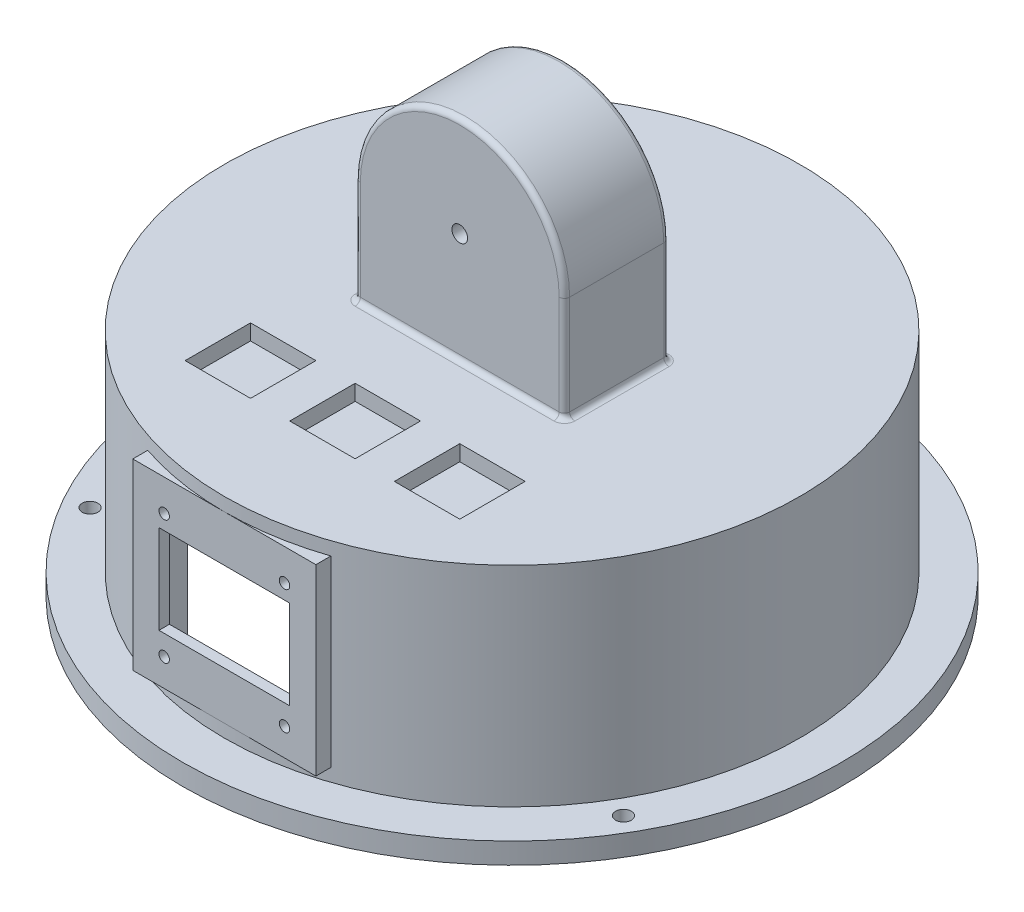
from build123d import *

# Parameters (mm, degrees)
SKETCH1_R            = 63
BOSS_EXTRUDE4_DEPTH  = 4
SKETCH2_R            = 55
BOSS_EXTRUDE5_DEPTH  = 40
SKETCH3_R            = 51
CUT_EXTRUDE1_DEPTH   = 40
SKETCH9_W            = 40
SKETCH9_H            = 20
BOSS_EXTRUDE8_DEPTH  = 0.001
BOSS_EXTRUDE9_DEPTH  = 20
SKETCH12_R           = 1.5
CUT_EXTRUDE4_DEPTH   = 20
BOSS_EXTRUDE10_START = -9
SKETCH22_W           = 35
SKETCH22_H           = 35
BOSS_EXTRUDE10_DEPTH = 9
SKETCH24_W           = 32
SKETCH24_H           = 32
CUT_EXTRUDE15_DEPTH  = 7
FILLET6_R            = 1
SKETCH25_W           = 25
SKETCH25_H           = 17
CUT_EXTRUDE16_DEPTH  = 2
SKETCH26_R           = 1
CUT_EXTRUDE18_DEPTH  = 2
SKETCH30_W           = 12.5
SKETCH30_H           = 12.5
CUT_EXTRUDE24_DEPTH  = 3
SKETCH29_R           = 1.5
CUT_EXTRUDE25_DEPTH  = 4


with BuildPart() as part:
    # Sketch1 → Boss-Extrude4 (new body)
    with BuildSketch(Plane(origin=(0, 0, 0), x_dir=(1, 0, 0), z_dir=(0, 1, 0))):
        with Locations(Location((0, 0, 0), (0, 0, 270))):
            Circle(SKETCH1_R)
    extrude(amount=BOSS_EXTRUDE4_DEPTH)

    # Sketch2 → Boss-Extrude5 (add)
    with BuildSketch(Plane(origin=(0, 4, 0), x_dir=(1, 0, 0), z_dir=(0, 1, 0))):
        with Locations(Location((0, 0, 0), (0, 0, 270))):
            Circle(SKETCH2_R)
    extrude(amount=BOSS_EXTRUDE5_DEPTH)

    # Sketch3 → Cut-Extrude1 (cut)
    with BuildSketch(Plane.XZ):
        with Locations(Location((0, 0, 0), (0, 0, 270))):
            Circle(SKETCH3_R)
    extrude(amount=-CUT_EXTRUDE1_DEPTH, mode=Mode.SUBTRACT)

    # Sketch9 → Boss-Extrude8 (add)
    with BuildSketch(Plane(origin=(0, 44, 0), x_dir=(1, 0, 0), z_dir=(0, 1, 0))):
        Rectangle(SKETCH9_W, SKETCH9_H)
    extrude(amount=BOSS_EXTRUDE8_DEPTH)

    # Sketch11 → Boss-Extrude9 (add)
    with BuildSketch(Plane(origin=(0, 0, -10), x_dir=(-1, 0, 0), z_dir=(0, 0, -1))):
        with BuildLine():
            Line((-20, 44.001), (-20, 64.001))
            ThreePointArc((-20, 64.001), (0, 84.001), (20, 64.001))
            Line((20, 64.001), (20, 44.001))
            Line((20, 44.001), (-20, 44.001))
        make_face()
    extrude(amount=-BOSS_EXTRUDE9_DEPTH)

    # Sketch12 → Cut-Extrude4 (cut)
    with BuildSketch(Plane.XY.offset(10)):
        with Locations((0, 65)):
            Circle(SKETCH12_R)
    extrude(amount=-CUT_EXTRUDE4_DEPTH, mode=Mode.SUBTRACT)

    # Sketch22 → Boss-Extrude10 (add)
    with BuildSketch(Plane.XY.offset(55).offset(BOSS_EXTRUDE10_START)):
        with Locations((0, 23.97160628)):
            Rectangle(SKETCH22_W, SKETCH22_H)
    extrude(amount=BOSS_EXTRUDE10_DEPTH)

    # Sketch24 → Cut-Extrude15 (cut)
    with BuildSketch(Plane(origin=(0, 0, 46), x_dir=(-1, 0, 0), z_dir=(0, 0, -1))):
        with Locations((0, 23.722591491)):
            Rectangle(SKETCH24_W, SKETCH24_H)
    extrude(amount=-CUT_EXTRUDE15_DEPTH, mode=Mode.SUBTRACT)

    # Fillet6
    fillet6_edges = [part.edges().sort_by_distance(p)[0] for p in [
        (-20, 44, 0),
        (-20, 54.0005, -10),
        (0, 44, 10),
        (-20, 54.0005, 10),
        (20, 44, 0),
        (20, 54.0005, 10),
        (0, 44, -10),
        (20, 54.0005, -10),
        (0, 84.001, -10),
        (0, 84.001, 10),
    ]]
    fillet(fillet6_edges, radius=FILLET6_R)

    # Sketch25 → Cut-Extrude16 (cut)
    with BuildSketch(Plane.XY.offset(55)):
        with Locations((0, 24.10057748)):
            Rectangle(SKETCH25_W, SKETCH25_H)
    extrude(amount=-CUT_EXTRUDE16_DEPTH, mode=Mode.SUBTRACT)

    # Sketch26 → Cut-Extrude18 (cut)
    with BuildSketch(Plane.XY.offset(55)):
        with Locations((-11.5, 35.429004604)):
            Circle(SKETCH26_R)
        with Locations((11.5, 35.429004604)):
            Circle(SKETCH26_R)
        with Locations((11.5, 11.727594133)):
            Circle(SKETCH26_R)
        with Locations((-11.5, 11.727594133)):
            Circle(SKETCH26_R)
    extrude(amount=-CUT_EXTRUDE18_DEPTH, mode=Mode.SUBTRACT)

    # Sketch30 → Cut-Extrude24 (cut)
    with BuildSketch(Plane(origin=(0, 44, 0), x_dir=(1, 0, 0), z_dir=(0, 1, 0))):
        with Locations((20, -30)):
            Rectangle(SKETCH30_W, SKETCH30_H)
        with Locations((0, -30)):
            Rectangle(SKETCH30_W, SKETCH30_H)
        with Locations((-20, -30)):
            Rectangle(SKETCH30_W, SKETCH30_H)
    extrude(amount=-CUT_EXTRUDE24_DEPTH, mode=Mode.SUBTRACT)

    # Sketch29 → Cut-Extrude25 (cut)
    with BuildSketch(Plane(origin=(0, 4, 0), x_dir=(1, 0, 0), z_dir=(0, 1, 0))):
        with Locations(Location((0, 59, 0), (0, 0, 270))):
            Circle(SKETCH29_R)
        with Locations(Location((-50.985971771, -29.688898305, 0), (0, 0, 270))):
            Circle(SKETCH29_R)
        with Locations(Location((50.985971771, -29.688898305, 0), (0, 0, 270))):
            Circle(SKETCH29_R)
    extrude(amount=-CUT_EXTRUDE25_DEPTH, mode=Mode.SUBTRACT)


solid = part.part
